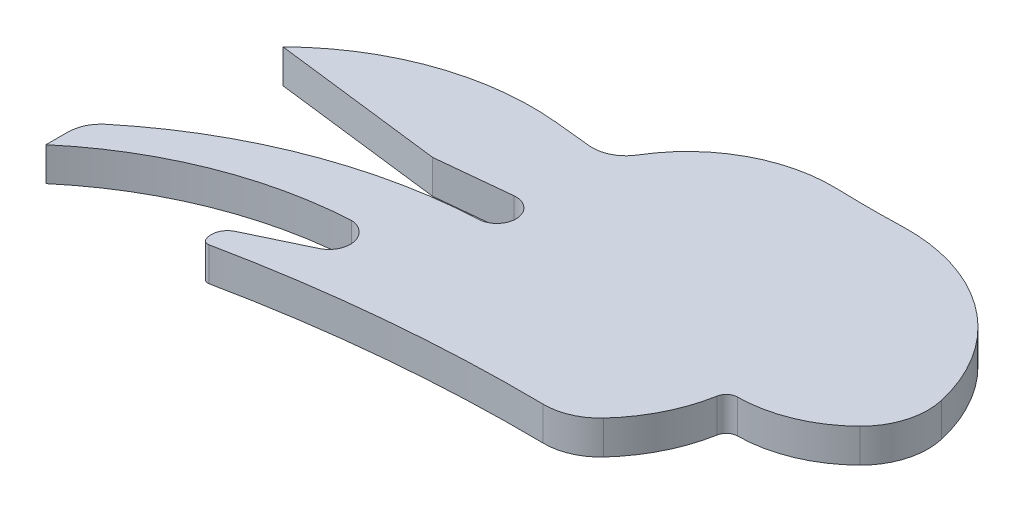
from build123d import *

# Parameters (mm, degrees)
BOSS_EXTRUDE1_DEPTH = 3
FILLET1_R           = 6
FILLET2_R           = 90
FILLET3_R           = 3
FILLET4_R           = 1
FILLET5_R           = 5
FILLET7_R           = 0.5


with BuildPart() as part:
    # Sketch1 → Boss-Extrude1 (new body)
    with BuildSketch(Plane(origin=(0, 0, 0), x_dir=(1, 0, 0), z_dir=(0, 1, 0))):
        with BuildLine():
            Line((26.26, 24.39), (21.003236337, 24.926095368))
            ThreePointArc((21.003236337, 24.926095368), (11.295062799, 23.773811444), (3, 18.6))
            Line((3, 18.6), (18.17, 16.74))
            Line((18.17, 16.74), (24.739702097, 17.401448676))
            ThreePointArc((24.739702097, 17.401448676), (26.605341282, 15.835769379), (24.991153908, 14.011938151))
            ThreePointArc((24.991153908, 14.011938151), (11.62395121, 11.060339085), (0, 3.83))
            Line((0, 3.83), (0, 0.53))
            ThreePointArc((0, 0.53), (9.076343052, 5.992821668), (19.42, 8.28))
            ThreePointArc((19.42, 8.28), (21.169232573, 6.746366569), (20.122543786, 4.668798598))
            Line((20.122543786, 4.668798598), (15.092493707, 2.268241119))
            ThreePointArc((15.092493707, 2.268241119), (14.296253692, 1.249322501), (14.63, 0))
            ThreePointArc((14.63, 0), (29.238150005, 2.169439215), (44, 2.607956962))
            ThreePointArc((44, 2.607956962), (47.61446857, 6.68515129), (49.32, 11.86))
            ThreePointArc((49.32, 11.86), (55.458987632, 13.234527387), (59.87, 17.72))
            ThreePointArc((59.87, 17.72), (54.010103044, 29.206202626), (41.4, 31.9))
            ThreePointArc((41.4, 31.9), (32.432757692, 30.961810725), (26.26, 24.39))
        make_face()
    extrude(amount=BOSS_EXTRUDE1_DEPTH)

    # Fillet1
    fillet1_edges = [part.edges().sort_by_distance(p)[0] for p in [
        (59.87, 1.5, -17.72),
    ]]
    fillet(fillet1_edges, radius=FILLET1_R)

    # Fillet2
    fillet2_edges = [part.edges().sort_by_distance(p)[0] for p in [
        (41.4, 1.5, -31.9),
    ]]
    fillet(fillet2_edges, radius=FILLET2_R)

    # Fillet3
    fillet3_edges = [part.edges().sort_by_distance(p)[0] for p in [
        (26.26, 1.5, -24.39),
        (0, 1.5, -3.83),
    ]]
    fillet(fillet3_edges, radius=FILLET3_R)

    # Fillet4
    fillet4_edges = [part.edges().sort_by_distance(p)[0] for p in [
        (49.32, 1.5, -11.86),
    ]]
    fillet(fillet4_edges, radius=FILLET4_R)

    # Fillet5
    fillet5_edges = [part.edges().sort_by_distance(p)[0] for p in [
        (44, 1.5, -2.607956962),
    ]]
    fillet(fillet5_edges, radius=FILLET5_R)

    # Fillet7
    fillet7_edges = [part.edges().sort_by_distance(p)[0] for p in [
        (14.63, 1.5, 0),
    ]]
    fillet(fillet7_edges, radius=FILLET7_R)


solid = part.part
